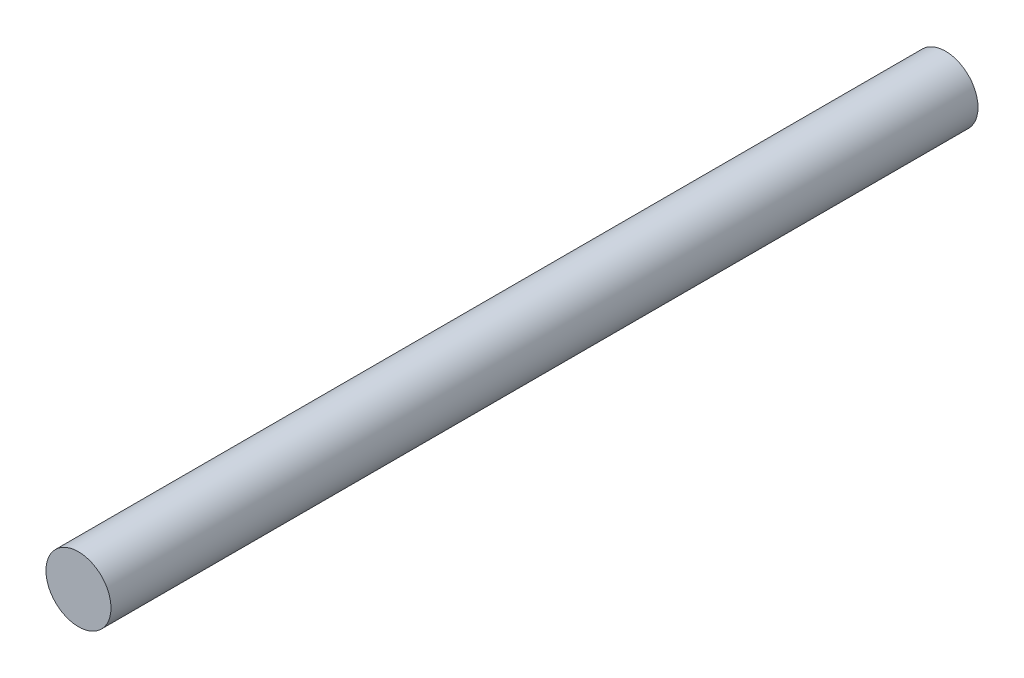
from build123d import *

# Parameters (mm, degrees)
ESQUISSE1_R        = 3
BOSS_EXTRU_1_DEPTH = 80


with BuildPart() as part:
    # Esquisse1 → Boss.-Extru.1 (new body)
    with BuildSketch(Plane.XY):
        Circle(ESQUISSE1_R)
    extrude(amount=BOSS_EXTRU_1_DEPTH)


solid = part.part
